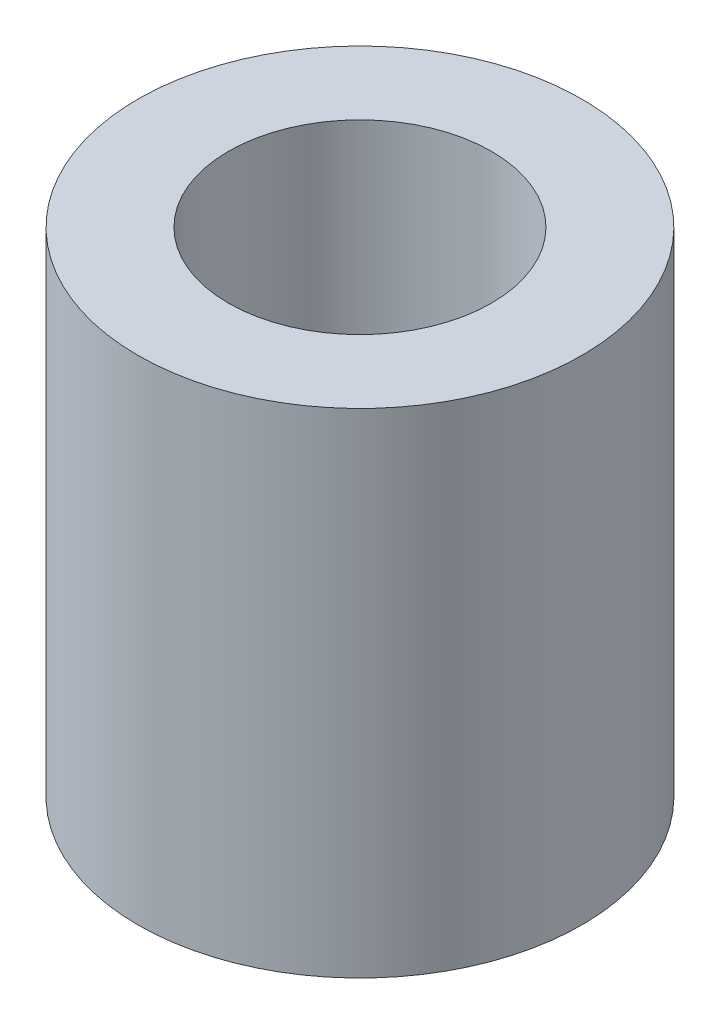
from build123d import *

# Parameters (mm, degrees)
SKETCH1_R           = 3.375
SKETCH1_R_2         = 2
BOSS_EXTRUDE1_DEPTH = 3.75


with BuildPart() as part:
    # Sketch1 → Boss-Extrude1 (new, symmetric)
    with BuildSketch(Plane(origin=(0, 0, 0), x_dir=(1, 0, 0), z_dir=(0, 1, 0))):
        with Locations(Location((0, 0, 0), (0, 0, 270))):
            Circle(SKETCH1_R)
        with Locations(Location((0, 0, 0), (0, 0, 270))):
            Circle(SKETCH1_R_2, mode=Mode.SUBTRACT)
    extrude(amount=BOSS_EXTRUDE1_DEPTH, both=True)


solid = part.part
